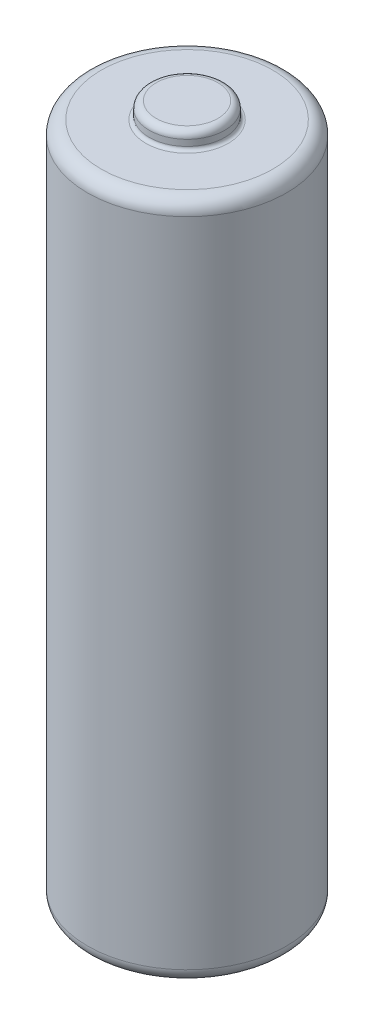
from build123d import *

# Parameters (mm, degrees)
SKETCH1_R           = 7.25
BOSS_EXTRUDE4_DEPTH = 49.5
SKETCH8_R           = 2.75
BOSS_EXTRUDE5_DEPTH = 1.2
FILLET1_R           = 1
FILLET3_R           = 0.25
FILLET4_R           = 0.5


with BuildPart() as part:
    # Sketch1 → Boss-Extrude4 (new body)
    with BuildSketch(Plane(origin=(0, 0, 0), x_dir=(1, 0, 0), z_dir=(0, 1, 0))):
        with Locations(Location((0, 0, 0), (0, 0, 270))):
            Circle(SKETCH1_R)
    extrude(amount=BOSS_EXTRUDE4_DEPTH)

    # Sketch8 → Boss-Extrude5 (add)
    with BuildSketch(Plane(origin=(0, 49.5, 0), x_dir=(1, 0, 0), z_dir=(0, 1, 0))):
        with Locations(Location((0, 0, 0), (0, 0, 270))):
            Circle(SKETCH8_R)
    extrude(amount=BOSS_EXTRUDE5_DEPTH)

    # Fillet1
    fillet1_edges = [part.edges().sort_by_distance(p)[0] for p in [
        (0, 0, -7.25),
        (0, 49.5, -7.25),
    ]]
    fillet(fillet1_edges, radius=FILLET1_R)

    # Fillet3
    fillet3_edges = [part.edges().sort_by_distance(p)[0] for p in [
        (0, 49.5, -2.75),
    ]]
    fillet(fillet3_edges, radius=FILLET3_R)

    # Fillet4
    fillet4_edges = [part.edges().sort_by_distance(p)[0] for p in [
        (0, 50.7, -2.75),
    ]]
    fillet(fillet4_edges, radius=FILLET4_R)


solid = part.part
